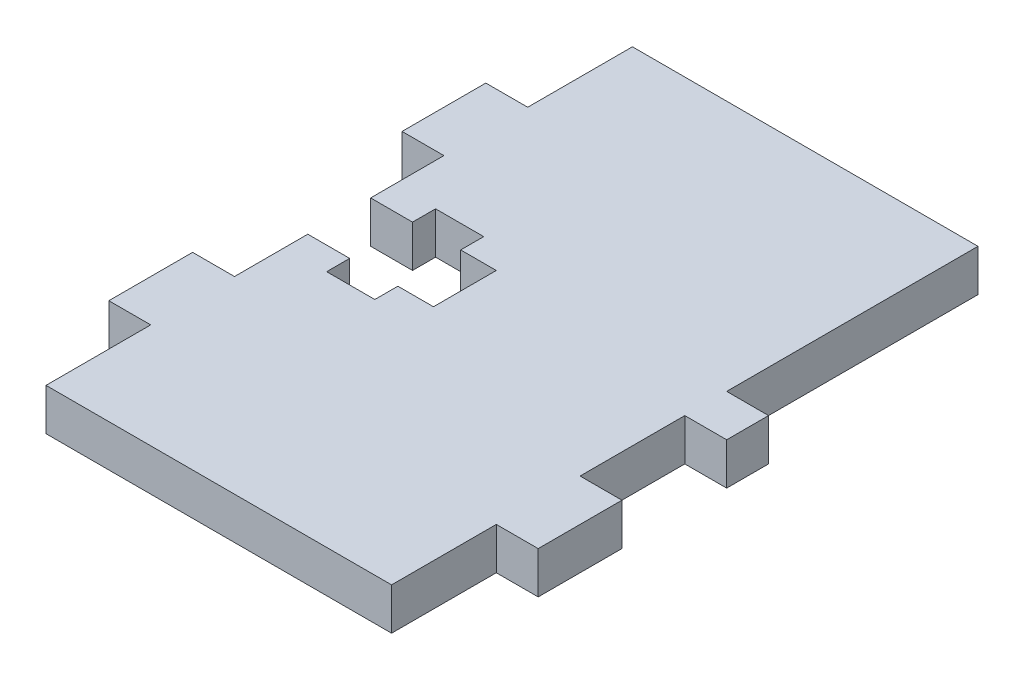
from build123d import *

# Parameters (mm, degrees)
BOSS_EXTRUDE1_DEPTH = 2


with BuildPart() as part:
    # Sketch1 → Boss-Extrude1 (new body)
    with BuildSketch(Plane(origin=(0, 0, 0), x_dir=(1, 0, 0), z_dir=(0, 1, 0))):
        Polygon((0, 0), (16.5, 0), (16.5, 5), (18.5, 5), (18.5, 9), (16.5, 9), (16.5, 14), (18.5, 14), (18.5, 16), (16.5, 16), (16.5, 28), (0, 28), (0, 23), (-2, 23), (-2, 19), (0, 19), (0, 15.5), (2, 15.5), (2, 16.6), (4.3, 16.6), (4.3, 15.5), (6, 15.5), (6, 12.5), (4.3, 12.5), (4.3, 11.4), (2, 11.4), (2, 12.5), (0, 12.5), (0, 9), (-2, 9), (-2, 5), (0, 5), align=None)
    extrude(amount=BOSS_EXTRUDE1_DEPTH)


solid = part.part
